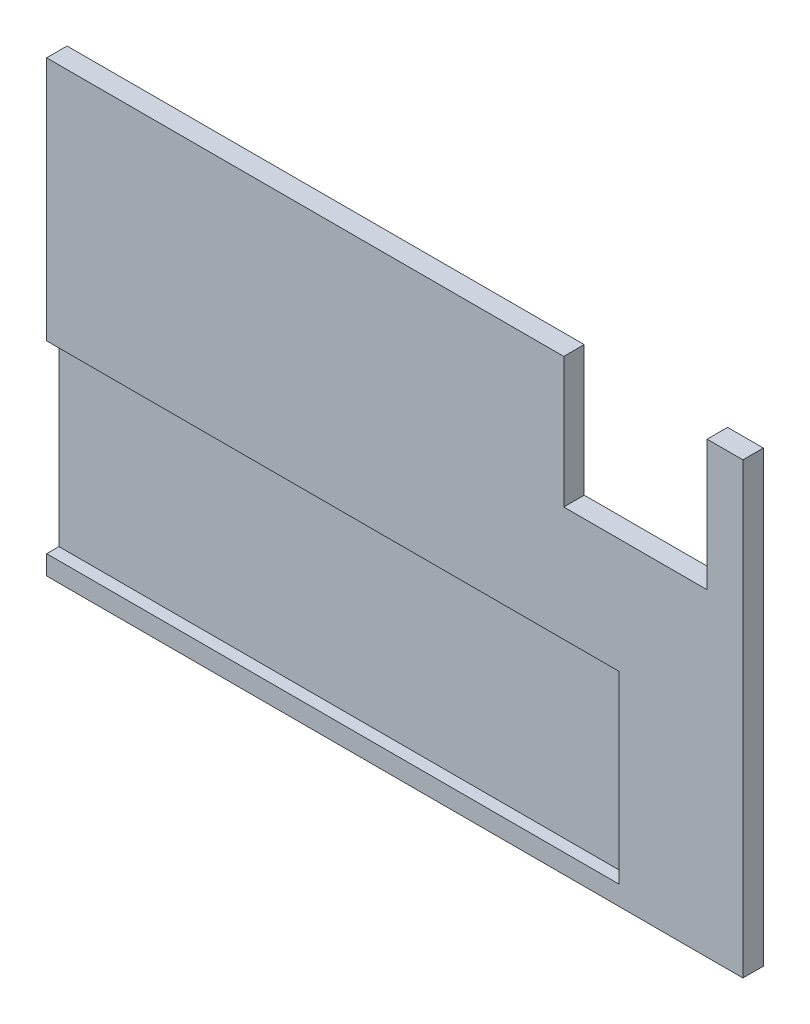
from build123d import *

# Parameters (mm, degrees)
BOSS_EXTRUDE1_DEPTH = 5
SKETCH2_W           = 140
SKETCH2_H           = 45
CUT_EXTRUDE1_DEPTH  = 3
SKETCH3_W           = 35
SKETCH3_H           = 32
CUT_EXTRUDE3_DEPTH  = 148.286881187


with BuildPart() as part:
    # Sketch1 → Boss-Extrude1 (new body)
    with BuildSketch(Plane.XY):
        Polygon((0, -2.718152765), (-101.259492884, -2.718152765), (-101.259492884, 106.840724775), (68.740507116, 106.840724775), (68.740507116, -2.718152765), align=None)
    extrude(amount=BOSS_EXTRUDE1_DEPTH)

    # Sketch2 → Cut-Extrude1 (cut)
    with BuildSketch(Plane.XY.offset(5)):
        with Locations((-31.52, 24.5)):
            Rectangle(SKETCH2_W, SKETCH2_H)
    extrude(amount=-CUT_EXTRUDE1_DEPTH, mode=Mode.SUBTRACT)

    # Sketch3 → Cut-Extrude3 (cut, through all)
    with BuildSketch(Plane.XY):
        with Locations((42.5, 91)):
            Rectangle(SKETCH3_W, SKETCH3_H)
    extrude(amount=CUT_EXTRUDE3_DEPTH, mode=Mode.SUBTRACT)


solid = part.part
